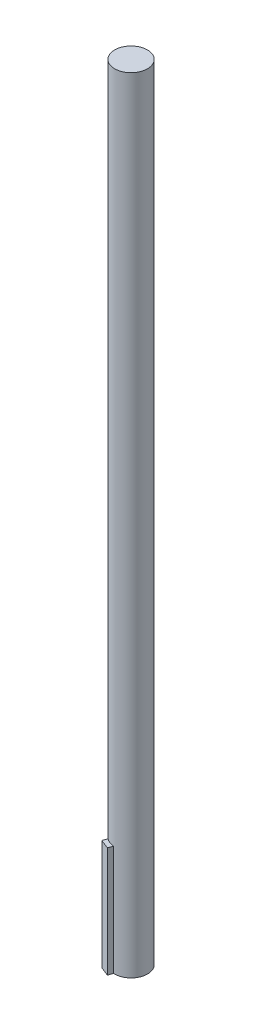
from build123d import *

# Parameters (mm, degrees)
BOSS_EXTRUDE1_DEPTH = 90
SKETCH3_R           = 13.36858006
BOSS_EXTRUDE2_DEPTH = 550


with BuildPart() as part:
    # Sketch2 → Boss-Extrude1 (new body)
    with BuildSketch(Plane(origin=(0, 0, 0), x_dir=(1, 0, 0), z_dir=(0, 1, 0))):
        with BuildLine():
            Line((-0.832718515, -13.342620159), (-2.264973014, -17.077408915))
            Line((-2.264973014, -17.077408915), (-9.734550526, -14.212899917))
            Line((-9.734550526, -14.212899917), (-8.302296027, -10.478111162))
            ThreePointArc((-8.302296027, -10.478111162), (4.786802233, 12.482205623), (-0.832718515, -13.342620159))
        make_face()
    extrude(amount=BOSS_EXTRUDE1_DEPTH)

    # Sketch3 → Boss-Extrude2 (add)
    with BuildSketch(Plane(origin=(0, 90, 0), x_dir=(1, 0, 0), z_dir=(0, 1, 0))):
        with Locations(Location((0, 0, 0), (0, 0, 231.608573475))):
            Circle(SKETCH3_R)
    extrude(amount=BOSS_EXTRUDE2_DEPTH)


solid = part.part
